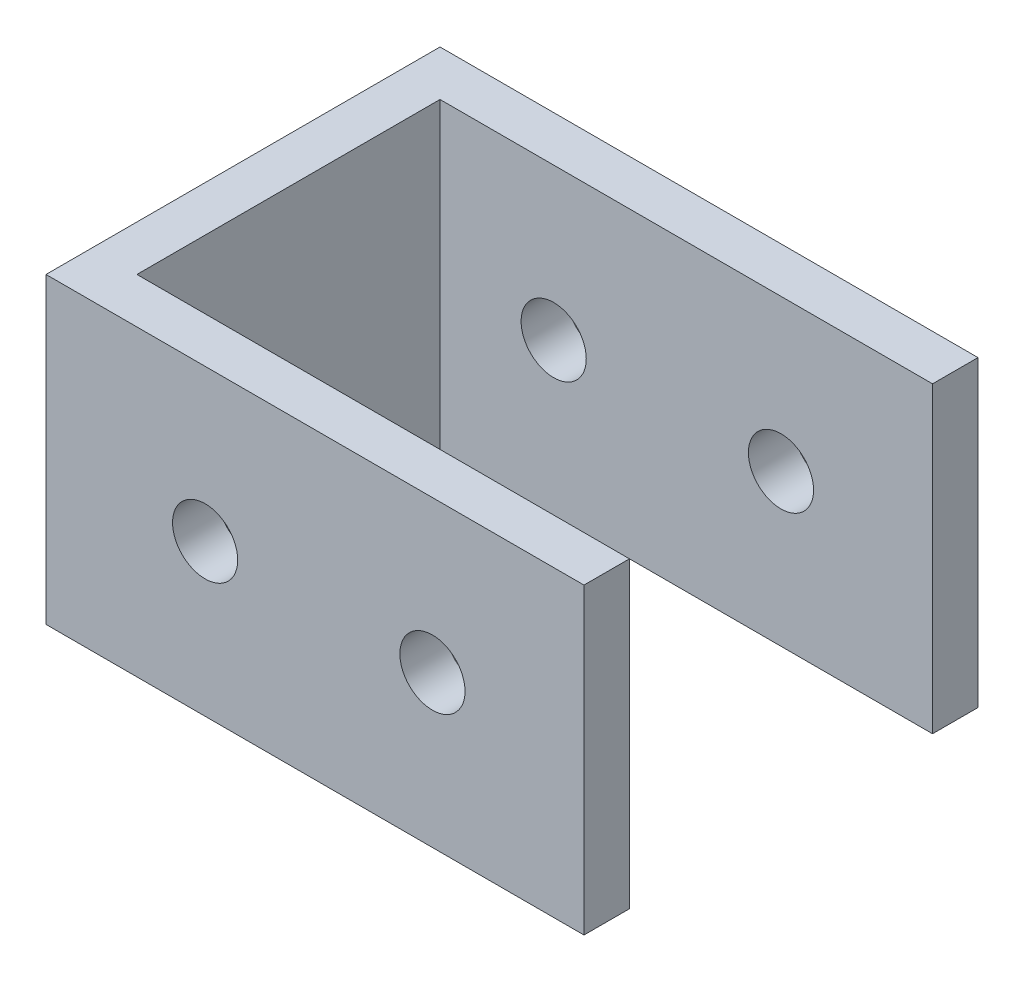
from build123d import *

# Parameters (mm, degrees)
BOSS_EXTRUDE1_DEPTH = 20
SKETCH2_R           = 2.15
CUT_EXTRUDE1_DEPTH  = 49.334770094


with BuildPart() as part:
    # Sketch1 → Boss-Extrude1 (new body)
    with BuildSketch(Plane(origin=(0, 0, 0), x_dir=(1, 0, 0), z_dir=(0, 1, 0))):
        Polygon((35.5, 23), (35.5, 26), (0, 26), (0, 0), (35.5, 0), (35.5, 3), (3, 3), (3, 23), align=None)
    extrude(amount=BOSS_EXTRUDE1_DEPTH)

    # Sketch2 → Cut-Extrude1 (cut, through all)
    with BuildSketch(Plane.XY):
        with Locations((10.5, 10)):
            Circle(SKETCH2_R)
        with Locations((25.5, 10)):
            Circle(SKETCH2_R)
    extrude(amount=-CUT_EXTRUDE1_DEPTH, mode=Mode.SUBTRACT)


solid = part.part
